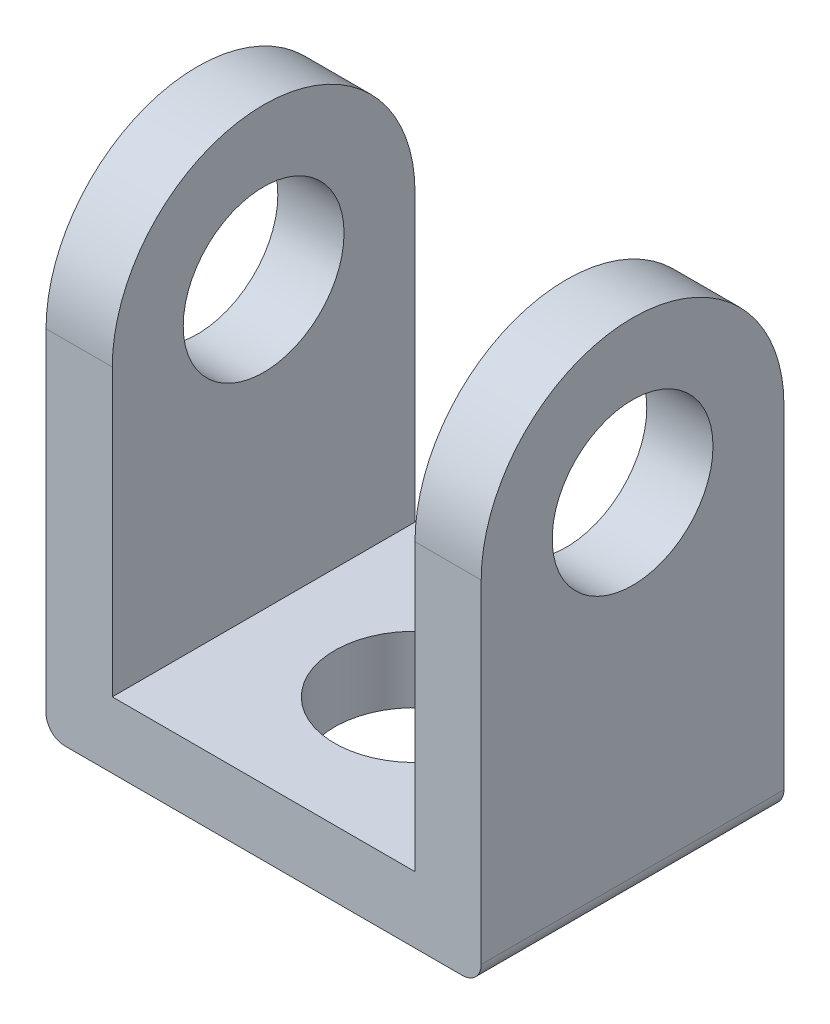
from build123d import *

# Parameters (mm, degrees)
SKETCH1_W           = 11.5
SKETCH1_H           = 8
BOSS_EXTRUDE1_DEPTH = 13.3
CUT_EXTRUDE1_REACH  = 20.032
SKETCH2_R           = 2.125
CUT_EXTRUDE2_REACH  = 20.032
CUT_EXTRUDE3_REACH  = 18.552
SKETCH4_W           = 8
SKETCH4_H           = 11.55
CUT_EXTRUDE4_REACH  = 17.032
SKETCH5_R           = 2.125
FILLET1_R           = 0.5


with BuildPart() as part:
    # Sketch1 → Boss-Extrude1 (new body)
    with BuildSketch(Plane(origin=(0, 0, 0), x_dir=(1, 0, 0), z_dir=(0, 1, 0))):
        Rectangle(SKETCH1_W, SKETCH1_H)
    extrude(amount=BOSS_EXTRUDE1_DEPTH)

    # Sketch2 → Cut-Extrude1 (cut, up to next)
    with BuildSketch(Plane(origin=(5.75, 0, 0), x_dir=(0, 0, -1), z_dir=(1, 0, 0)), mode=Mode.PRIVATE) as cut_extrude1_sk1:
        with Locations((0, 9.3)):
            Circle(SKETCH2_R)
    cut_extrude1_tool1 = extrude(cut_extrude1_sk1.sketch, amount=-CUT_EXTRUDE1_REACH, mode=Mode.PRIVATE) & part.part
    add(cut_extrude1_tool1.solids().sort_by_distance((5.75, 9.3, 0))[0], mode=Mode.SUBTRACT)

    # Sketch3 → Cut-Extrude2 (cut, up to next)
    with BuildSketch(Plane(origin=(5.75, 0, 0), x_dir=(0, 0, -1), z_dir=(1, 0, 0)), mode=Mode.PRIVATE) as cut_extrude2_sk1:
        with BuildLine():
            Line((4, 13.3), (0, 13.3))
            ThreePointArc((0, 13.3), (2.828427125, 12.128427125), (4, 9.3))
            Line((4, 9.3), (4, 13.3))
        make_face()
    cut_extrude2_tool1 = extrude(cut_extrude2_sk1.sketch, amount=-CUT_EXTRUDE2_REACH, mode=Mode.PRIVATE) & part.part
    # Sketch3 → Cut-Extrude2 (cut, up to next)
    with BuildSketch(Plane(origin=(5.75, 0, 0), x_dir=(0, 0, -1), z_dir=(1, 0, 0)), mode=Mode.PRIVATE) as cut_extrude2_sk2:
        with BuildLine():
            Line((0, 13.3), (-4, 13.3))
            Line((-4, 13.3), (-4, 9.3))
            ThreePointArc((-4, 9.3), (-2.828427125, 12.128427125), (0, 13.3))
        make_face()
    cut_extrude2_tool2 = extrude(cut_extrude2_sk2.sketch, amount=-CUT_EXTRUDE2_REACH, mode=Mode.PRIVATE) & part.part
    add(cut_extrude2_tool1.solids().sort_by_distance((5.75, 12.406528, -3.106528))[0], mode=Mode.SUBTRACT)
    add(cut_extrude2_tool2.solids().sort_by_distance((5.75, 12.406528, 3.106528))[0], mode=Mode.SUBTRACT)

    # Sketch4 → Cut-Extrude3 (cut, up to next)
    with BuildSketch(Plane.XY.offset(4), mode=Mode.PRIVATE) as cut_extrude3_sk1:
        with Locations((0, 7.525)):
            Rectangle(SKETCH4_W, SKETCH4_H)
    cut_extrude3_tool1 = extrude(cut_extrude3_sk1.sketch, amount=-CUT_EXTRUDE3_REACH, mode=Mode.PRIVATE) & part.part
    add(cut_extrude3_tool1.solids().sort_by_distance((0, 7.525, 4))[0], mode=Mode.SUBTRACT)

    # Sketch5 → Cut-Extrude4 (cut, up to next)
    with BuildSketch(Plane.XZ, mode=Mode.PRIVATE) as cut_extrude4_sk1:
        with Locations(Location((0, 0, 0), (0, 0, 270))):
            Circle(SKETCH5_R)
    cut_extrude4_tool1 = extrude(cut_extrude4_sk1.sketch, amount=-CUT_EXTRUDE4_REACH, mode=Mode.PRIVATE) & part.part
    add(cut_extrude4_tool1.solids().sort_by_distance((0, 0, 0))[0], mode=Mode.SUBTRACT)

    # Fillet1
    fillet1_edges = [part.edges().sort_by_distance(p)[0] for p in [
        (5.75, 0, 0),
        (-5.75, 0, 0),
    ]]
    fillet(fillet1_edges, radius=FILLET1_R)


solid = part.part
